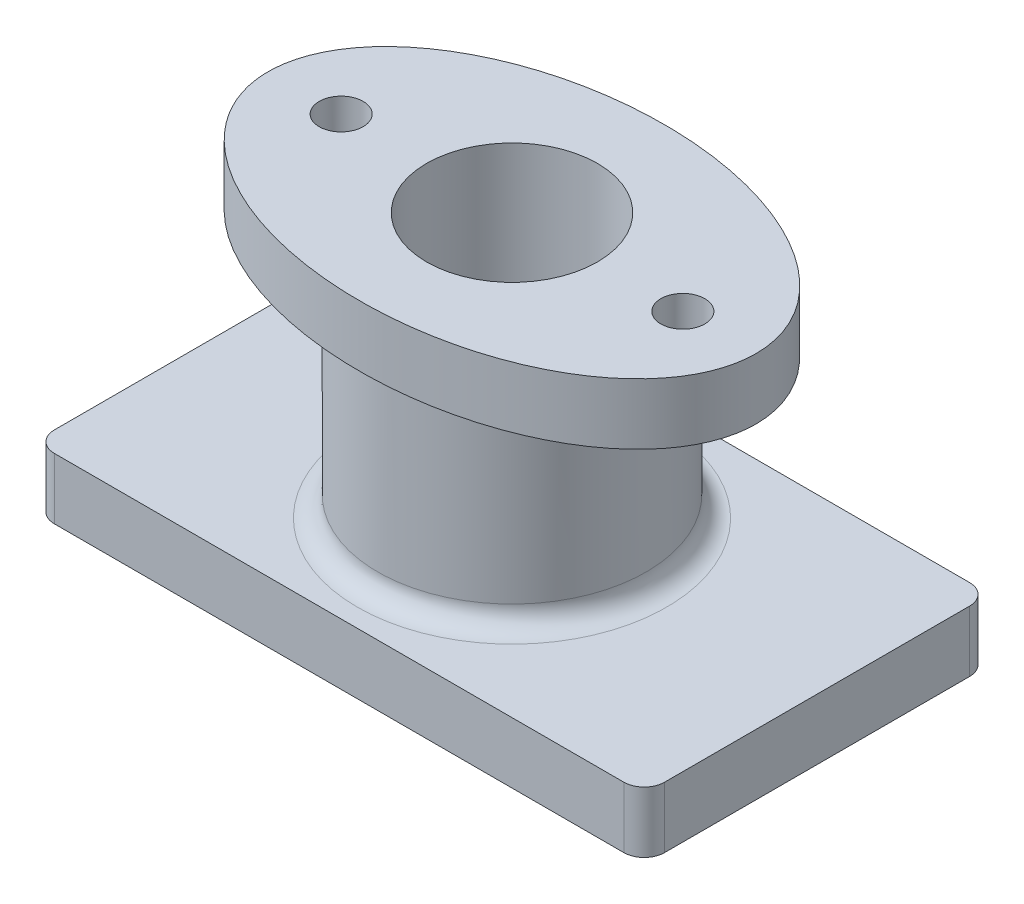
from build123d import *

# Parameters (mm, degrees)
EXTRUDE_1_DEPTH     = 15
SKETCH_2_R          = 33
EXTRUDE_2_DEPTH     = 50
SKETCH_3_RX         = 60
SKETCH_3_RY         = 37.5
EXTRUDE_3_DEPTH     = 15
SKETCH_4_R          = 21
CUT_EXTRUDE_1_DEPTH = 65
CUT_EXTRUDE_2_REACH = 119.606
SKETCH_5_R          = 16.5
CUT_EXTRUDE_3_REACH = 119.606
SKETCH_6_R          = 5.4
FILLET_1_R          = 5


with BuildPart() as part:
    # 草图1 → 凸台-拉伸1 (new body)
    with BuildSketch(Plane(origin=(0, 0, 0), x_dir=(1, 0, 0), z_dir=(0, 1, 0))):
        with BuildLine():
            Line((-70, -42.5), (70, -42.5))
            ThreePointArc((70, -42.5), (73.535533906, -41.035533906), (75, -37.5))
            Line((75, -37.5), (75, 37.5))
            ThreePointArc((75, 37.5), (73.535533906, 41.035533906), (70, 42.5))
            Line((70, 42.5), (-70, 42.5))
            ThreePointArc((-70, 42.5), (-73.535533906, 41.035533906), (-75, 37.5))
            Line((-75, 37.5), (-75, -37.5))
            ThreePointArc((-75, -37.5), (-73.535533906, -41.035533906), (-70, -42.5))
        make_face()
    extrude(amount=EXTRUDE_1_DEPTH)

    # 草图2 → 凸台-拉伸2 (add)
    with BuildSketch(Plane(origin=(0, 15, 0), x_dir=(1, 0, 0), z_dir=(0, 1, 0))):
        with Locations(Location((0, 0, 0), (0, 0, 90))):
            Circle(SKETCH_2_R)
    extrude(amount=EXTRUDE_2_DEPTH)

    # 草图3 → 凸台-拉伸3 (add)
    with BuildSketch(Plane(origin=(0, 65, 0), x_dir=(1, 0, 0), z_dir=(0, 1, 0))):
        with Locations((0, 0)):
            Ellipse(SKETCH_3_RX, SKETCH_3_RY)
    extrude(amount=EXTRUDE_3_DEPTH)

    # 草图4 → 切除-拉伸1 (cut)
    with BuildSketch(Plane(origin=(0, 80, 0), x_dir=(1, 0, 0), z_dir=(0, 1, 0))):
        with Locations(Location((0, 0, 0), (0, 0, 270))):
            Circle(SKETCH_4_R)
    extrude(amount=-CUT_EXTRUDE_1_DEPTH, mode=Mode.SUBTRACT)

    # 草图5 → 切除-拉伸2 (cut, up to next)
    with BuildSketch(Plane.XZ, mode=Mode.PRIVATE) as cut_extrude_2_sk1:
        with Locations(Location((0, 0, 0), (0, 0, 270))):
            Circle(SKETCH_5_R)
    cut_extrude_2_tool1 = extrude(cut_extrude_2_sk1.sketch, amount=-CUT_EXTRUDE_2_REACH, mode=Mode.PRIVATE) & part.part
    add(cut_extrude_2_tool1.solids().sort_by_distance((0, 0, 0))[0], mode=Mode.SUBTRACT)

    # 草图6 → 切除-拉伸3 (cut, up to next)
    with BuildSketch(Plane(origin=(0, 80, 0), x_dir=(1, 0, 0), z_dir=(0, 1, 0)), mode=Mode.PRIVATE) as cut_extrude_3_sk1:
        with Locations(Location((42, 0, 0), (0, 0, 270))):
            Circle(SKETCH_6_R)
    cut_extrude_3_tool1 = extrude(cut_extrude_3_sk1.sketch, amount=-CUT_EXTRUDE_3_REACH, mode=Mode.PRIVATE) & part.part
    # 草图6 → 切除-拉伸3 (cut, up to next)
    with BuildSketch(Plane(origin=(0, 80, 0), x_dir=(1, 0, 0), z_dir=(0, 1, 0)), mode=Mode.PRIVATE) as cut_extrude_3_sk2:
        with Locations(Location((-42, 0, 0), (0, 0, 270))):
            Circle(SKETCH_6_R)
    cut_extrude_3_tool2 = extrude(cut_extrude_3_sk2.sketch, amount=-CUT_EXTRUDE_3_REACH, mode=Mode.PRIVATE) & part.part
    add(cut_extrude_3_tool1.solids().sort_by_distance((42, 80, 0))[0], mode=Mode.SUBTRACT)
    add(cut_extrude_3_tool2.solids().sort_by_distance((-42, 80, 0))[0], mode=Mode.SUBTRACT)

    # 圆角1
    fillet_1_edges = [part.edges().sort_by_distance(p)[0] for p in [
        (0, 15, 33),
    ]]
    fillet(fillet_1_edges, radius=FILLET_1_R)


solid = part.part
